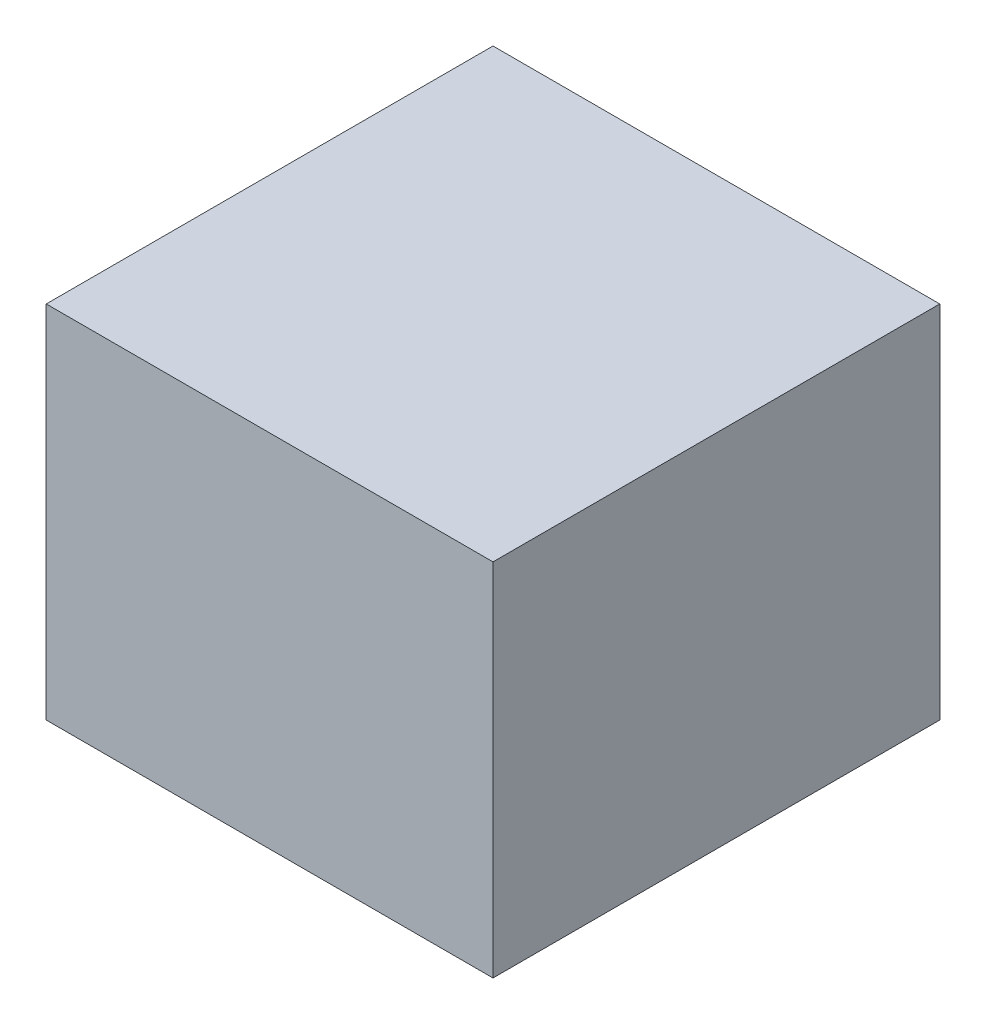
from build123d import *

# Parameters (mm, degrees)
SKETCH1_W           = 45
SKETCH1_H           = 45
BOSS_EXTRUDE1_DEPTH = 36.3


with BuildPart() as part:
    # Sketch1 → Boss-Extrude1 (new body)
    with BuildSketch(Plane(origin=(0, 0, 0), x_dir=(1, 0, 0), z_dir=(0, 1, 0))):
        with Locations((22.5, 22.5)):
            Rectangle(SKETCH1_W, SKETCH1_H)
    extrude(amount=BOSS_EXTRUDE1_DEPTH)


solid = part.part
